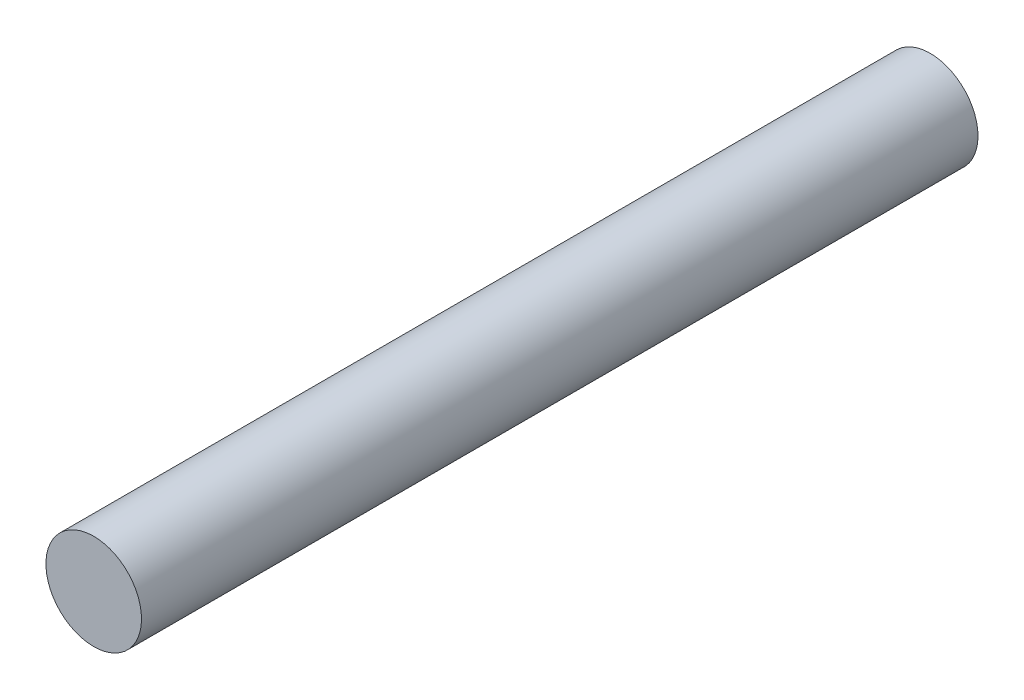
from build123d import *

# Parameters (mm, degrees)
SKETCH_1_R      = 1
EXTRUDE_1_DEPTH = 17.5


with BuildPart() as part:
    # 草图1 → 凸台-拉伸1 (new body)
    with BuildSketch(Plane.XY):
        Circle(SKETCH_1_R)
    extrude(amount=EXTRUDE_1_DEPTH)


solid = part.part
